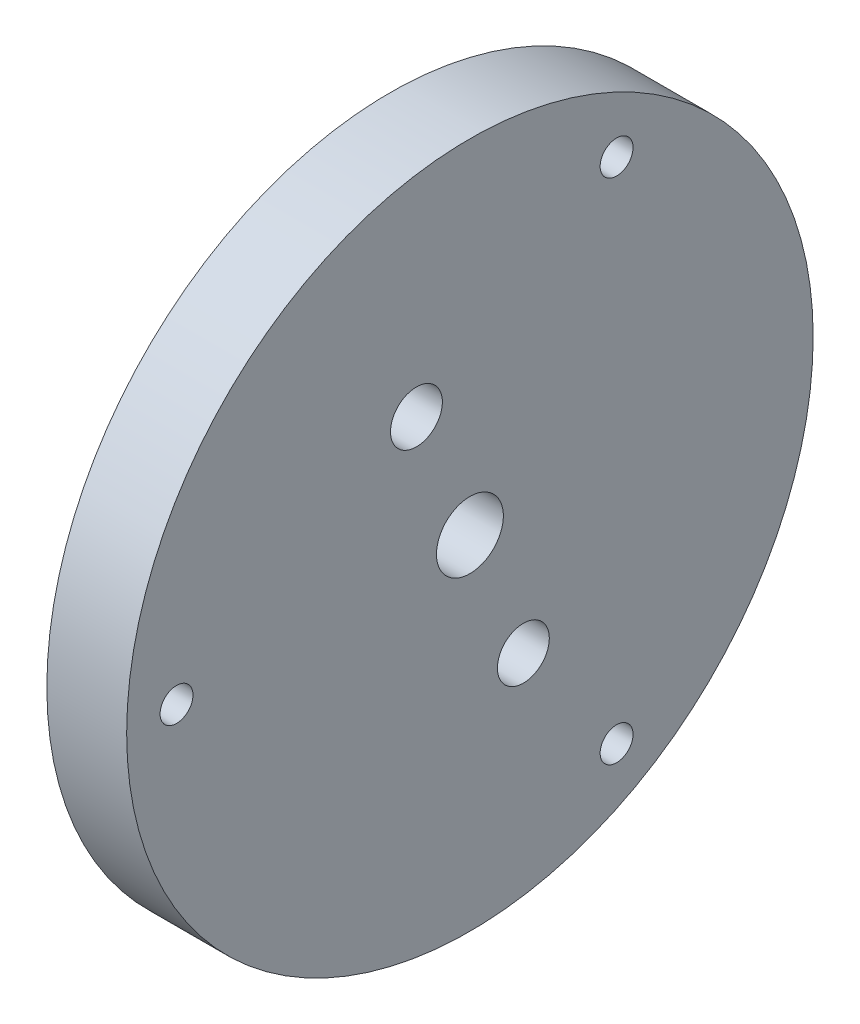
from build123d import *

# Parameters (mm, degrees)
AXIAL_PROFILE_MM_W     = 8
AXIAL_PROFILE_MM_H     = 31.05
AXIAL_HOLES_DEPTH      = 165.078060691
AXIAL_HOLES_DEPTH_BACK = 165.078060691
SKETCH2_R              = 2.6
SKETCH2_R_2            = 1.65


with BuildPart() as part:
    # Axial profile (mm) → Full revolution (revolve)
    with BuildSketch(Plane.XY, mode=Mode.PRIVATE) as full_revolution_sk:
        with Locations((152.7, 18.875)):
            Rectangle(AXIAL_PROFILE_MM_W, AXIAL_PROFILE_MM_H)
    revolve(full_revolution_sk.sketch.rotate(Axis((-110, 0, 0), (1, 0, 0)), 90), axis=Axis((-110, 0, 0), (1, 0, 0)))

    # Sketch2 → Axial holes (cut, two sides: drawn at the far end of the back side and taken through both)
    with BuildSketch(Plane(origin=(0, 0, 0), x_dir=(0, 0, -1), z_dir=(1, 0, 0)).offset(-AXIAL_HOLES_DEPTH_BACK)):
        with Locations((-5.357568053, 12.934313455)):
            Circle(SKETCH2_R)
        with Locations((5.357568053, -12.934313455)):
            Circle(SKETCH2_R)
        with Locations((-29.4, 0)):
            Circle(SKETCH2_R_2)
        with Locations((14.7, -25.461146871)):
            Circle(SKETCH2_R_2)
        with Locations((14.7, 25.461146871)):
            Circle(SKETCH2_R_2)
    extrude(amount=AXIAL_HOLES_DEPTH + AXIAL_HOLES_DEPTH_BACK, mode=Mode.SUBTRACT)


solid = part.part
